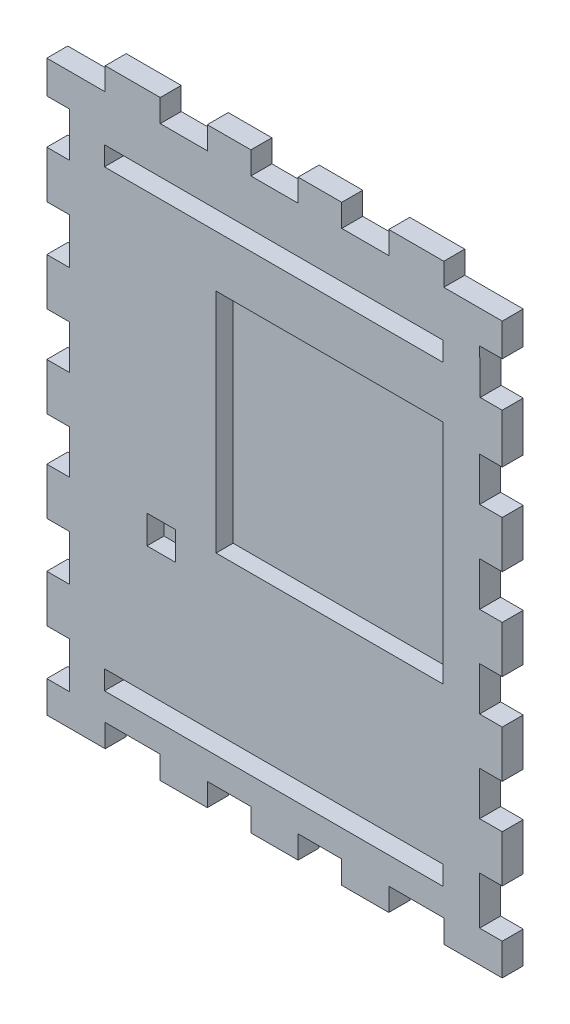
from build123d import *

# Parameters (mm, degrees)
MODEL_W             = 59.689998908
MODEL_H             = 3.386668819
MODEL_H_2           = 3.3866668
BOSS_EXTRUDE1_DEPTH = 3.7
SKETCH1_W           = 2.5
SKETCH1_H           = 2.5
SKETCH1_W_2         = 40
SKETCH1_H_2         = 40
CUT_EXTRUDE1_DEPTH  = 3


with BuildPart() as part:
    # Model → Boss-Extrude1 (new body)
    with BuildSketch(Plane.XY):
        Polygon((7.659321824, 131.185313162), (11.645711781, 131.185313467), (11.645711781, 123.120135193), (7.659323163, 123.120135799), (7.659323163, 114.794580784), (11.645711704, 114.794580995), (11.645711704, 106.729402721), (7.659323085, 106.729402721), (7.659322496, 101.163927511), (17.960431856, 101.163927511), (17.960431856, 105.185592023), (27.661820742, 105.185592023), (27.661820742, 101.163927511), (35.952098518, 101.163927511), (35.952098518, 105.185592023), (43.642655148, 105.185592023), (43.642655148, 101.163927511), (51.968212855, 101.163927511), (51.968212855, 105.185592023), (59.658766793, 105.185592023), (59.658766793, 101.163927511), (67.949044569, 101.163927511), (67.949044569, 105.185592023), (77.650433456, 105.185592023), (77.650433456, 101.163927511), (87.951545673, 101.163927511), (87.951545673, 106.78652537), (83.965155709, 106.78652537), (83.965155709, 115.20447842), (87.951545673, 115.204478756), (87.951545673, 123.494756532), (83.965155708, 123.494756532), (83.965155708, 131.185313162), (87.951545168, 131.185313162), (87.951545168, 139.475590938), (83.965156213, 139.475590938), (83.965156213, 147.166147568), (87.951545168, 147.166147568), (87.951545168, 155.456425344), (83.965156213, 155.456425344), (83.965156213, 163.182259213), (87.951545168, 163.182259213), (87.951545168, 171.472536989), (83.965156213, 171.472536989), (83.965156213, 179.163092274), (87.951545169, 179.163092274), (87.951545169, 187.851347209), (84.066213746, 187.851347204), (83.965155204, 195.685953684), (87.951545169, 195.685953684), (87.951544665, 201.458647414), (77.650433455, 201.458647414), (77.650433455, 205.445036033), (67.949044569, 205.445036033), (67.949044569, 201.458647414), (59.658766793, 201.458647414), (59.658766793, 205.445036033), (51.968212854, 205.445036033), (51.968212854, 201.458647414), (43.642655148, 201.458647414), (43.642655148, 205.445036033), (35.952098517, 205.445036033), (35.952098517, 201.458647414), (27.661820742, 201.458647414), (27.661820742, 205.445036033), (17.960431855, 205.445036033), (17.960431855, 201.458647414), (7.659323162, 201.458647414), (7.659321865, 195.685953684), (11.645710483, 195.685953684), (11.645711788, 187.863269672), (7.65932317, 187.863269672), (7.65932317, 179.537714657), (11.645711788, 179.537715263), (11.645711788, 171.472536989), (7.659321824, 171.472536989), (7.659321824, 163.182259214), (11.645711789, 163.182259214), (11.645711789, 155.456425344), (7.659321824, 155.456425344), (7.659321824, 147.166147568), (11.645711789, 147.166147568), (11.645711789, 139.475590938), (7.659321824, 139.475590938), align=None)
        with Locations((47.664322352, 111.627811013)):
            Rectangle(MODEL_W, MODEL_H, mode=Mode.SUBTRACT)
        with Locations((47.664322352, 191.629758602)):
            Rectangle(MODEL_W, MODEL_H_2, mode=Mode.SUBTRACT)
    extrude(amount=BOSS_EXTRUDE1_DEPTH)

    # Sketch1 → Cut-Extrude1 (cut)
    with BuildSketch(Plane.XY.offset(3.7)):
        with Locations((26.569322898, 137.071145422)):
            Rectangle(SKETCH1_W, SKETCH1_H)
        Polygon((27.819322898, 138.321145422), (27.819322898, 135.821145422), (30.319322898, 135.821145422), (30.319322898, 140.821145422), (25.319322898, 140.821145422), (25.319322898, 138.321145422), align=None)
        with Locations((57.509321806, 160.821145422)):
            Rectangle(SKETCH1_W_2, SKETCH1_H_2)
    extrude(amount=-CUT_EXTRUDE1_DEPTH, mode=Mode.SUBTRACT)


solid = part.part
